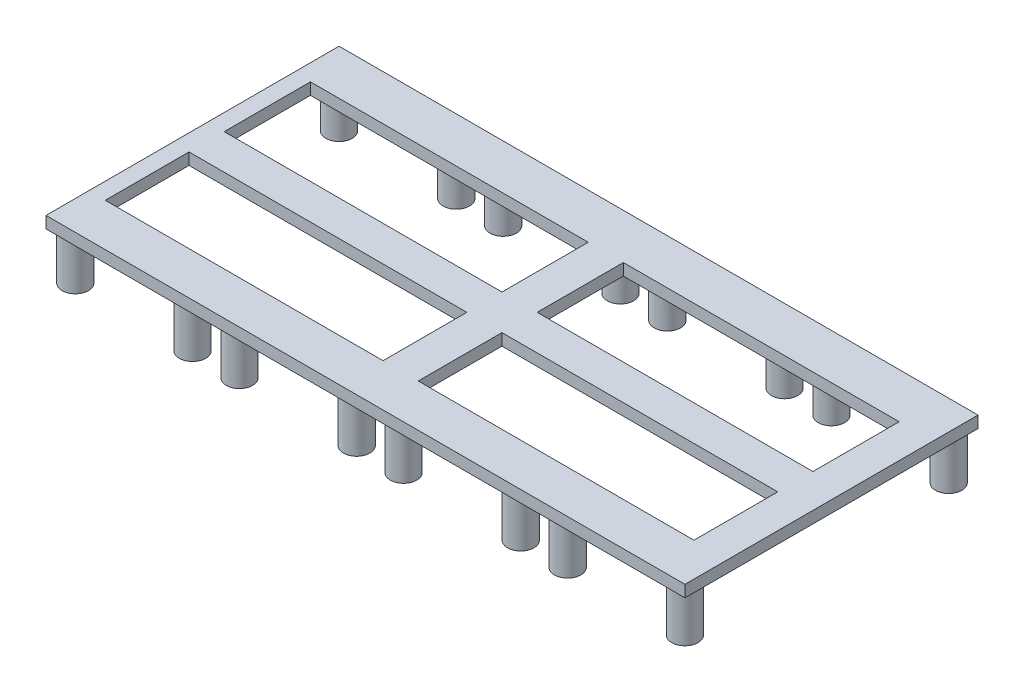
from build123d import *

# Parameters (mm, degrees)
SKETCH_1_W          = 25
SKETCH_1_H          = 50
SKETCH_1_R          = 2.25
SKETCH_1_W_2        = 20
SKETCH_1_H_2        = 45
EXTRUDE_1_DEPTH     = 2
EXTRUDE_2_DEPTH     = 8
SKETCH_4_W          = 28
SKETCH_4_H          = 50
EXTRUDE_3_DEPTH     = 2
EXTRUDE_4_DEPTH     = 8
SKETCH_6_W          = 28
SKETCH_6_H          = 50
EXTRUDE_5_DEPTH     = 2
EXTRUDE_6_DEPTH     = 8
SKETCH_8_W          = 28
SKETCH_8_H          = 50
EXTRUDE_7_DEPTH     = 2
EXTRUDE_8_DEPTH     = 8
SKETCH_10_W         = 47.04690413
SKETCH_10_H         = 14.711544942
SKETCH_10_W_2       = 47.389144047
SKETCH_10_H_2       = 14.288455058
CUT_EXTRUDE_1_DEPTH = 2


with BuildPart() as part:
    # 草图1 → 凸台-拉伸1 (new body)
    # profile 1 of 38: a face of its own
    with BuildSketch(Plane(origin=(0, 0, 0), x_dir=(1, 0, 0), z_dir=(0, 1, 0))):
        with Locations((-2.413747545, 14.420748303)):
            Rectangle(SKETCH_1_W, SKETCH_1_H)
        with Locations((-12.413747545, -8.079251697)):
            Circle(SKETCH_1_R, mode=Mode.SUBTRACT)
        with Locations((-12.413747545, 36.920748303)):
            Circle(SKETCH_1_R, mode=Mode.SUBTRACT)
        with Locations((7.586252455, 36.920748303)):
            Circle(SKETCH_1_R, mode=Mode.SUBTRACT)
        with Locations((7.586252455, -8.079251697)):
            Circle(SKETCH_1_R, mode=Mode.SUBTRACT)
        with Locations((-2.413747545, 14.420748303)):
            Rectangle(SKETCH_1_W_2, SKETCH_1_H_2, mode=Mode.SUBTRACT)
    # profile 2 of 38: a face of its own
    with BuildSketch(Plane(origin=(0, 0, 0), x_dir=(1, 0, 0), z_dir=(0, 1, 0))):
        with Locations((-2.413747545, 14.420748303)):
            Rectangle(SKETCH_1_W_2, SKETCH_1_H_2)
    # profile 3 of 38: a face of its own
    with BuildSketch(Plane(origin=(0, 0, 0), x_dir=(1, 0, 0), z_dir=(0, 1, 0))):
        with Locations((-12.413747545, 36.920748303)):
            Circle(SKETCH_1_R)
    # profile 4 of 38: a face of its own
    with BuildSketch(Plane(origin=(0, 0, 0), x_dir=(1, 0, 0), z_dir=(0, 1, 0))):
        with Locations((7.586252455, 36.920748303)):
            Circle(SKETCH_1_R)
    # profile 5 of 38: a face of its own
    with BuildSketch(Plane(origin=(0, 0, 0), x_dir=(1, 0, 0), z_dir=(0, 1, 0))):
        with Locations((7.586252455, -8.079251697)):
            Circle(SKETCH_1_R)
    # profile 6 of 38: a face of its own
    with BuildSketch(Plane(origin=(0, 0, 0), x_dir=(1, 0, 0), z_dir=(0, 1, 0))):
        with Locations((-12.413747545, -8.079251697)):
            Circle(SKETCH_1_R)
    # profile 7 of 38: a face of its own
    with BuildSketch(Plane(origin=(0, 0, 0), x_dir=(1, 0, 0), z_dir=(0, 1, 0))):
        with BuildLine():
            ThreePointArc((9.836252455, 36.920748303), (7.586252455, 39.170748303), (5.336252455, 36.920748303))
            Line((5.336252455, 36.920748303), (6.086252455, 36.920748303))
            ThreePointArc((6.086252455, 36.920748303), (7.586252455, 38.420748303), (9.086252455, 36.920748303))
            ThreePointArc((9.086252455, 36.920748303), (8.646912627, 35.860088131), (7.586252455, 35.420748303))
            Line((7.586252455, 35.420748303), (7.586252455, 34.670748303))
            ThreePointArc((7.586252455, 34.670748303), (9.177242713, 35.329758045), (9.836252455, 36.920748303))
        make_face()
    # profile 8 of 38: a face of its own
    with BuildSketch(Plane(origin=(0, 0, 0), x_dir=(1, 0, 0), z_dir=(0, 1, 0))):
        with BuildLine():
            Line((6.086252455, 36.920748303), (5.336252455, 36.920748303))
            ThreePointArc((5.336252455, 36.920748303), (5.995262198, 35.329758045), (7.586252455, 34.670748303))
            Line((7.586252455, 34.670748303), (7.586252455, 35.420748303))
            ThreePointArc((7.586252455, 35.420748303), (6.525592284, 35.860088131), (6.086252455, 36.920748303))
        make_face()
    # profile 9 of 38: a face of its own
    with BuildSketch(Plane(origin=(0, 0, 0), x_dir=(1, 0, 0), z_dir=(0, 1, 0))):
        with BuildLine():
            ThreePointArc((9.086252455, 36.920748303), (7.586252455, 38.420748303), (6.086252455, 36.920748303))
            Line((6.086252455, 36.920748303), (7.586252455, 36.920748303))
            Line((7.586252455, 36.920748303), (7.586252455, 35.420748303))
            ThreePointArc((7.586252455, 35.420748303), (8.646912627, 35.860088131), (9.086252455, 36.920748303))
        make_face()
    # profile 10 of 38: a face of its own
    with BuildSketch(Plane(origin=(0, 0, 0), x_dir=(1, 0, 0), z_dir=(0, 1, 0))):
        with BuildLine():
            Line((7.586252455, 36.920748303), (6.086252455, 36.920748303))
            ThreePointArc((6.086252455, 36.920748303), (6.525592284, 35.860088131), (7.586252455, 35.420748303))
            Line((7.586252455, 35.420748303), (7.586252455, 36.920748303))
        make_face()
    # profile 11 of 38: a face of its own
    with BuildSketch(Plane(origin=(0, 0, 0), x_dir=(1, 0, 0), z_dir=(0, 1, 0))):
        with BuildLine():
            ThreePointArc((9.086252455, 36.920748303), (7.586252455, 38.420748303), (6.086252455, 36.920748303))
            Line((6.086252455, 36.920748303), (7.586252455, 36.920748303))
            Line((7.586252455, 36.920748303), (7.586252455, 35.420748303))
            ThreePointArc((7.586252455, 35.420748303), (8.646912627, 35.860088131), (9.086252455, 36.920748303))
        make_face()
    # profile 12 of 38: a face of its own
    with BuildSketch(Plane(origin=(0, 0, 0), x_dir=(1, 0, 0), z_dir=(0, 1, 0))):
        with BuildLine():
            Line((7.586252455, 36.920748303), (6.086252455, 36.920748303))
            ThreePointArc((6.086252455, 36.920748303), (6.525592284, 35.860088131), (7.586252455, 35.420748303))
            Line((7.586252455, 35.420748303), (7.586252455, 36.920748303))
        make_face()
    # profile 13 of 38: a face of its own
    with BuildSketch(Plane(origin=(0, 0, 0), x_dir=(1, 0, 0), z_dir=(0, 1, 0))):
        with BuildLine():
            ThreePointArc((9.836252455, 36.920748303), (7.586252455, 39.170748303), (5.336252455, 36.920748303))
            Line((5.336252455, 36.920748303), (6.086252455, 36.920748303))
            ThreePointArc((6.086252455, 36.920748303), (7.586252455, 38.420748303), (9.086252455, 36.920748303))
            ThreePointArc((9.086252455, 36.920748303), (8.646912627, 35.860088131), (7.586252455, 35.420748303))
            Line((7.586252455, 35.420748303), (7.586252455, 34.670748303))
            ThreePointArc((7.586252455, 34.670748303), (9.177242713, 35.329758045), (9.836252455, 36.920748303))
        make_face()
    # profile 14 of 38: a face of its own
    with BuildSketch(Plane(origin=(0, 0, 0), x_dir=(1, 0, 0), z_dir=(0, 1, 0))):
        with BuildLine():
            Line((6.086252455, 36.920748303), (5.336252455, 36.920748303))
            ThreePointArc((5.336252455, 36.920748303), (5.995262198, 35.329758045), (7.586252455, 34.670748303))
            Line((7.586252455, 34.670748303), (7.586252455, 35.420748303))
            ThreePointArc((7.586252455, 35.420748303), (6.525592284, 35.860088131), (6.086252455, 36.920748303))
        make_face()
    # profile 15 of 38: a face of its own
    with BuildSketch(Plane(origin=(0, 0, 0), x_dir=(1, 0, 0), z_dir=(0, 1, 0))):
        with BuildLine():
            ThreePointArc((-12.413747545, 35.420748303), (-13.474407716, 37.981408475), (-10.913747545, 36.920748303))
            Line((-10.913747545, 36.920748303), (-10.163747545, 36.920748303))
            ThreePointArc((-10.163747545, 36.920748303), (-14.004737802, 38.511738561), (-12.413747545, 34.670748303))
            Line((-12.413747545, 34.670748303), (-12.413747545, 35.420748303))
        make_face()
    # profile 16 of 38: a face of its own
    with BuildSketch(Plane(origin=(0, 0, 0), x_dir=(1, 0, 0), z_dir=(0, 1, 0))):
        with BuildLine():
            Line((-10.163747545, 36.920748303), (-10.913747545, 36.920748303))
            ThreePointArc((-10.913747545, 36.920748303), (-11.353087373, 35.860088131), (-12.413747545, 35.420748303))
            Line((-12.413747545, 35.420748303), (-12.413747545, 34.670748303))
            ThreePointArc((-12.413747545, 34.670748303), (-10.822757287, 35.329758045), (-10.163747545, 36.920748303))
        make_face()
    # profile 17 of 38: a face of its own
    with BuildSketch(Plane(origin=(0, 0, 0), x_dir=(1, 0, 0), z_dir=(0, 1, 0))):
        with BuildLine():
            Line((-12.413747545, 35.420748303), (-12.413747545, 36.920748303))
            Line((-12.413747545, 36.920748303), (-10.913747545, 36.920748303))
            ThreePointArc((-10.913747545, 36.920748303), (-13.474407716, 37.981408475), (-12.413747545, 35.420748303))
        make_face()
    # profile 18 of 38: a face of its own
    with BuildSketch(Plane(origin=(0, 0, 0), x_dir=(1, 0, 0), z_dir=(0, 1, 0))):
        with BuildLine():
            Line((-10.913747545, 36.920748303), (-12.413747545, 36.920748303))
            Line((-12.413747545, 36.920748303), (-12.413747545, 35.420748303))
            ThreePointArc((-12.413747545, 35.420748303), (-11.353087373, 35.860088131), (-10.913747545, 36.920748303))
        make_face()
    # profile 19 of 38: a face of its own
    with BuildSketch(Plane(origin=(0, 0, 0), x_dir=(1, 0, 0), z_dir=(0, 1, 0))):
        with BuildLine():
            Line((-12.413747545, 35.420748303), (-12.413747545, 36.920748303))
            Line((-12.413747545, 36.920748303), (-10.913747545, 36.920748303))
            ThreePointArc((-10.913747545, 36.920748303), (-13.474407716, 37.981408475), (-12.413747545, 35.420748303))
        make_face()
    # profile 20 of 38: a face of its own
    with BuildSketch(Plane(origin=(0, 0, 0), x_dir=(1, 0, 0), z_dir=(0, 1, 0))):
        with BuildLine():
            Line((-10.913747545, 36.920748303), (-12.413747545, 36.920748303))
            Line((-12.413747545, 36.920748303), (-12.413747545, 35.420748303))
            ThreePointArc((-12.413747545, 35.420748303), (-11.353087373, 35.860088131), (-10.913747545, 36.920748303))
        make_face()
    # profile 21 of 38: a face of its own
    with BuildSketch(Plane(origin=(0, 0, 0), x_dir=(1, 0, 0), z_dir=(0, 1, 0))):
        with BuildLine():
            ThreePointArc((-12.413747545, 35.420748303), (-13.474407716, 37.981408475), (-10.913747545, 36.920748303))
            Line((-10.913747545, 36.920748303), (-10.163747545, 36.920748303))
            ThreePointArc((-10.163747545, 36.920748303), (-14.004737802, 38.511738561), (-12.413747545, 34.670748303))
            Line((-12.413747545, 34.670748303), (-12.413747545, 35.420748303))
        make_face()
    # profile 22 of 38: a face of its own
    with BuildSketch(Plane(origin=(0, 0, 0), x_dir=(1, 0, 0), z_dir=(0, 1, 0))):
        with BuildLine():
            Line((-10.163747545, 36.920748303), (-10.913747545, 36.920748303))
            ThreePointArc((-10.913747545, 36.920748303), (-11.353087373, 35.860088131), (-12.413747545, 35.420748303))
            Line((-12.413747545, 35.420748303), (-12.413747545, 34.670748303))
            ThreePointArc((-12.413747545, 34.670748303), (-10.822757287, 35.329758045), (-10.163747545, 36.920748303))
        make_face()
    # profile 23 of 38: a face of its own
    with BuildSketch(Plane(origin=(0, 0, 0), x_dir=(1, 0, 0), z_dir=(0, 1, 0))):
        with BuildLine():
            ThreePointArc((9.836252455, -8.079251697), (9.177242713, -6.488261439), (7.586252455, -5.829251697))
            Line((7.586252455, -5.829251697), (7.586252455, -6.579251697))
            ThreePointArc((7.586252455, -6.579251697), (8.646912627, -7.018591525), (9.086252455, -8.079251697))
            ThreePointArc((9.086252455, -8.079251697), (7.586252455, -9.579251697), (6.086252455, -8.079251697))
            Line((6.086252455, -8.079251697), (5.336252455, -8.079251697))
            ThreePointArc((5.336252455, -8.079251697), (7.586252455, -10.329251697), (9.836252455, -8.079251697))
        make_face()
    # profile 24 of 38: a face of its own
    with BuildSketch(Plane(origin=(0, 0, 0), x_dir=(1, 0, 0), z_dir=(0, 1, 0))):
        with BuildLine():
            Line((7.586252455, -6.579251697), (7.586252455, -5.829251697))
            ThreePointArc((7.586252455, -5.829251697), (5.995262198, -6.488261439), (5.336252455, -8.079251697))
            Line((5.336252455, -8.079251697), (6.086252455, -8.079251697))
            ThreePointArc((6.086252455, -8.079251697), (6.525592284, -7.018591525), (7.586252455, -6.579251697))
        make_face()
    # profile 25 of 38: a face of its own
    with BuildSketch(Plane(origin=(0, 0, 0), x_dir=(1, 0, 0), z_dir=(0, 1, 0))):
        with BuildLine():
            ThreePointArc((9.086252455, -8.079251697), (8.646912627, -7.018591525), (7.586252455, -6.579251697))
            Line((7.586252455, -6.579251697), (7.586252455, -8.079251697))
            Line((7.586252455, -8.079251697), (6.086252455, -8.079251697))
            ThreePointArc((6.086252455, -8.079251697), (7.586252455, -9.579251697), (9.086252455, -8.079251697))
        make_face()
    # profile 26 of 38: a face of its own
    with BuildSketch(Plane(origin=(0, 0, 0), x_dir=(1, 0, 0), z_dir=(0, 1, 0))):
        with BuildLine():
            Line((7.586252455, -8.079251697), (7.586252455, -6.579251697))
            ThreePointArc((7.586252455, -6.579251697), (6.525592284, -7.018591525), (6.086252455, -8.079251697))
            Line((6.086252455, -8.079251697), (7.586252455, -8.079251697))
        make_face()
    # profile 27 of 38: a face of its own
    with BuildSketch(Plane(origin=(0, 0, 0), x_dir=(1, 0, 0), z_dir=(0, 1, 0))):
        with BuildLine():
            ThreePointArc((9.836252455, -8.079251697), (9.177242713, -6.488261439), (7.586252455, -5.829251697))
            Line((7.586252455, -5.829251697), (7.586252455, -6.579251697))
            ThreePointArc((7.586252455, -6.579251697), (8.646912627, -7.018591525), (9.086252455, -8.079251697))
            ThreePointArc((9.086252455, -8.079251697), (7.586252455, -9.579251697), (6.086252455, -8.079251697))
            Line((6.086252455, -8.079251697), (5.336252455, -8.079251697))
            ThreePointArc((5.336252455, -8.079251697), (7.586252455, -10.329251697), (9.836252455, -8.079251697))
        make_face()
    # profile 28 of 38: a face of its own
    with BuildSketch(Plane(origin=(0, 0, 0), x_dir=(1, 0, 0), z_dir=(0, 1, 0))):
        with BuildLine():
            Line((7.586252455, -6.579251697), (7.586252455, -5.829251697))
            ThreePointArc((7.586252455, -5.829251697), (5.995262198, -6.488261439), (5.336252455, -8.079251697))
            Line((5.336252455, -8.079251697), (6.086252455, -8.079251697))
            ThreePointArc((6.086252455, -8.079251697), (6.525592284, -7.018591525), (7.586252455, -6.579251697))
        make_face()
    # profile 29 of 38: a face of its own
    with BuildSketch(Plane(origin=(0, 0, 0), x_dir=(1, 0, 0), z_dir=(0, 1, 0))):
        with BuildLine():
            ThreePointArc((9.086252455, -8.079251697), (8.646912627, -7.018591525), (7.586252455, -6.579251697))
            Line((7.586252455, -6.579251697), (7.586252455, -8.079251697))
            Line((7.586252455, -8.079251697), (6.086252455, -8.079251697))
            ThreePointArc((6.086252455, -8.079251697), (7.586252455, -9.579251697), (9.086252455, -8.079251697))
        make_face()
    # profile 30 of 38: a face of its own
    with BuildSketch(Plane(origin=(0, 0, 0), x_dir=(1, 0, 0), z_dir=(0, 1, 0))):
        with BuildLine():
            Line((7.586252455, -8.079251697), (7.586252455, -6.579251697))
            ThreePointArc((7.586252455, -6.579251697), (6.525592284, -7.018591525), (6.086252455, -8.079251697))
            Line((6.086252455, -8.079251697), (7.586252455, -8.079251697))
        make_face()
    # profile 31 of 38: a face of its own
    with BuildSketch(Plane(origin=(0, 0, 0), x_dir=(1, 0, 0), z_dir=(0, 1, 0))):
        with BuildLine():
            ThreePointArc((-10.913747545, -8.079251697), (-11.353087373, -7.018591525), (-12.413747545, -6.579251697))
            Line((-12.413747545, -6.579251697), (-12.413747545, -8.079251697))
            Line((-12.413747545, -8.079251697), (-10.913747545, -8.079251697))
        make_face()
    # profile 32 of 38: a face of its own
    with BuildSketch(Plane(origin=(0, 0, 0), x_dir=(1, 0, 0), z_dir=(0, 1, 0))):
        with BuildLine():
            Line((-12.413747545, -8.079251697), (-12.413747545, -6.579251697))
            ThreePointArc((-12.413747545, -6.579251697), (-13.474407716, -9.139911869), (-10.913747545, -8.079251697))
            Line((-10.913747545, -8.079251697), (-12.413747545, -8.079251697))
        make_face()
    # profile 33 of 38: a face of its own
    with BuildSketch(Plane(origin=(0, 0, 0), x_dir=(1, 0, 0), z_dir=(0, 1, 0))):
        with BuildLine():
            ThreePointArc((-10.163747545, -8.079251697), (-10.822757287, -6.488261439), (-12.413747545, -5.829251697))
            Line((-12.413747545, -5.829251697), (-12.413747545, -6.579251697))
            ThreePointArc((-12.413747545, -6.579251697), (-11.353087373, -7.018591525), (-10.913747545, -8.079251697))
            Line((-10.913747545, -8.079251697), (-10.163747545, -8.079251697))
        make_face()
    # profile 34 of 38: a face of its own
    with BuildSketch(Plane(origin=(0, 0, 0), x_dir=(1, 0, 0), z_dir=(0, 1, 0))):
        with BuildLine():
            Line((-12.413747545, -6.579251697), (-12.413747545, -5.829251697))
            ThreePointArc((-12.413747545, -5.829251697), (-14.004737802, -9.670241955), (-10.163747545, -8.079251697))
            Line((-10.163747545, -8.079251697), (-10.913747545, -8.079251697))
            ThreePointArc((-10.913747545, -8.079251697), (-13.474407716, -9.139911869), (-12.413747545, -6.579251697))
        make_face()
    # profile 35 of 38: a face of its own
    with BuildSketch(Plane(origin=(0, 0, 0), x_dir=(1, 0, 0), z_dir=(0, 1, 0))):
        with BuildLine():
            ThreePointArc((-10.913747545, -8.079251697), (-11.353087373, -7.018591525), (-12.413747545, -6.579251697))
            Line((-12.413747545, -6.579251697), (-12.413747545, -8.079251697))
            Line((-12.413747545, -8.079251697), (-10.913747545, -8.079251697))
        make_face()
    # profile 36 of 38: a face of its own
    with BuildSketch(Plane(origin=(0, 0, 0), x_dir=(1, 0, 0), z_dir=(0, 1, 0))):
        with BuildLine():
            Line((-12.413747545, -8.079251697), (-12.413747545, -6.579251697))
            ThreePointArc((-12.413747545, -6.579251697), (-13.474407716, -9.139911869), (-10.913747545, -8.079251697))
            Line((-10.913747545, -8.079251697), (-12.413747545, -8.079251697))
        make_face()
    # profile 37 of 38: a face of its own
    with BuildSketch(Plane(origin=(0, 0, 0), x_dir=(1, 0, 0), z_dir=(0, 1, 0))):
        with BuildLine():
            ThreePointArc((-10.163747545, -8.079251697), (-10.822757287, -6.488261439), (-12.413747545, -5.829251697))
            Line((-12.413747545, -5.829251697), (-12.413747545, -6.579251697))
            ThreePointArc((-12.413747545, -6.579251697), (-11.353087373, -7.018591525), (-10.913747545, -8.079251697))
            Line((-10.913747545, -8.079251697), (-10.163747545, -8.079251697))
        make_face()
    # profile 38 of 38: a face of its own
    with BuildSketch(Plane(origin=(0, 0, 0), x_dir=(1, 0, 0), z_dir=(0, 1, 0))):
        with BuildLine():
            Line((-12.413747545, -6.579251697), (-12.413747545, -5.829251697))
            ThreePointArc((-12.413747545, -5.829251697), (-14.004737802, -9.670241955), (-10.163747545, -8.079251697))
            Line((-10.163747545, -8.079251697), (-10.913747545, -8.079251697))
            ThreePointArc((-10.913747545, -8.079251697), (-13.474407716, -9.139911869), (-12.413747545, -6.579251697))
        make_face()
    extrude(amount=EXTRUDE_1_DEPTH)

    # 草图2 → 凸台-拉伸2 (add)
    with BuildSketch(Plane.XZ):
        with BuildLine():
            ThreePointArc((-12.413747545, 6.579251697), (-13.474407716, 9.139911869), (-10.913747545, 8.079251697))
            Line((-10.913747545, 8.079251697), (-10.163747545, 8.079251697))
            ThreePointArc((-10.163747545, 8.079251697), (-14.004737802, 9.670241955), (-12.413747545, 5.829251697))
            Line((-12.413747545, 5.829251697), (-12.413747545, 6.579251697))
        make_face()
        with BuildLine():
            Line((-10.163747545, 8.079251697), (-10.913747545, 8.079251697))
            ThreePointArc((-10.913747545, 8.079251697), (-11.353087373, 7.018591525), (-12.413747545, 6.579251697))
            Line((-12.413747545, 6.579251697), (-12.413747545, 5.829251697))
            ThreePointArc((-12.413747545, 5.829251697), (-10.822757287, 6.488261439), (-10.163747545, 8.079251697))
        make_face()
        with BuildLine():
            ThreePointArc((9.836252455, 8.079251697), (7.586252455, 10.329251697), (5.336252455, 8.079251697))
            Line((5.336252455, 8.079251697), (6.086252455, 8.079251697))
            ThreePointArc((6.086252455, 8.079251697), (7.586252455, 9.579251697), (9.086252455, 8.079251697))
            ThreePointArc((9.086252455, 8.079251697), (8.646912627, 7.018591525), (7.586252455, 6.579251697))
            Line((7.586252455, 6.579251697), (7.586252455, 5.829251697))
            ThreePointArc((7.586252455, 5.829251697), (9.177242713, 6.488261439), (9.836252455, 8.079251697))
        make_face()
        with BuildLine():
            Line((6.086252455, 8.079251697), (5.336252455, 8.079251697))
            ThreePointArc((5.336252455, 8.079251697), (5.995262198, 6.488261439), (7.586252455, 5.829251697))
            Line((7.586252455, 5.829251697), (7.586252455, 6.579251697))
            ThreePointArc((7.586252455, 6.579251697), (6.525592284, 7.018591525), (6.086252455, 8.079251697))
        make_face()
        with BuildLine():
            ThreePointArc((-10.163747545, -36.920748303), (-10.822757287, -35.329758045), (-12.413747545, -34.670748303))
            Line((-12.413747545, -34.670748303), (-12.413747545, -35.420748303))
            ThreePointArc((-12.413747545, -35.420748303), (-11.353087373, -35.860088131), (-10.913747545, -36.920748303))
            Line((-10.913747545, -36.920748303), (-10.163747545, -36.920748303))
        make_face()
        with BuildLine():
            Line((-12.413747545, -35.420748303), (-12.413747545, -34.670748303))
            ThreePointArc((-12.413747545, -34.670748303), (-14.004737802, -38.511738561), (-10.163747545, -36.920748303))
            Line((-10.163747545, -36.920748303), (-10.913747545, -36.920748303))
            ThreePointArc((-10.913747545, -36.920748303), (-13.474407716, -37.981408475), (-12.413747545, -35.420748303))
        make_face()
        with BuildLine():
            ThreePointArc((9.836252455, -36.920748303), (9.177242713, -35.329758045), (7.586252455, -34.670748303))
            Line((7.586252455, -34.670748303), (7.586252455, -35.420748303))
            ThreePointArc((7.586252455, -35.420748303), (8.646912627, -35.860088131), (9.086252455, -36.920748303))
            ThreePointArc((9.086252455, -36.920748303), (7.586252455, -38.420748303), (6.086252455, -36.920748303))
            Line((6.086252455, -36.920748303), (5.336252455, -36.920748303))
            ThreePointArc((5.336252455, -36.920748303), (7.586252455, -39.170748303), (9.836252455, -36.920748303))
        make_face()
        with BuildLine():
            Line((7.586252455, -35.420748303), (7.586252455, -34.670748303))
            ThreePointArc((7.586252455, -34.670748303), (5.995262198, -35.329758045), (5.336252455, -36.920748303))
            Line((5.336252455, -36.920748303), (6.086252455, -36.920748303))
            ThreePointArc((6.086252455, -36.920748303), (6.525592284, -35.860088131), (7.586252455, -35.420748303))
        make_face()
    extrude(amount=EXTRUDE_2_DEPTH)

    # 草图4 → 凸台-拉伸3 (add)
    with BuildSketch(Plane.XZ):
        with Locations((24.086252455, -14.420748303)):
            Rectangle(SKETCH_4_W, SKETCH_4_H)
    extrude(amount=-EXTRUDE_3_DEPTH)

    # 草图5 → 凸台-拉伸4 (add)
    with BuildSketch(Plane.XZ):
        with BuildLine():
            ThreePointArc((15.586252455, 6.579251697), (14.525592284, 9.139911869), (17.086252455, 8.079251697))
            Line((17.086252455, 8.079251697), (17.836252455, 8.079251697))
            ThreePointArc((17.836252455, 8.079251697), (13.995262198, 9.670241955), (15.586252455, 5.829251697))
            Line((15.586252455, 5.829251697), (15.586252455, 6.579251697))
        make_face()
        with BuildLine():
            Line((17.836252455, 8.079251697), (17.086252455, 8.079251697))
            ThreePointArc((17.086252455, 8.079251697), (16.646912627, 7.018591525), (15.586252455, 6.579251697))
            Line((15.586252455, 6.579251697), (15.586252455, 5.829251697))
            ThreePointArc((15.586252455, 5.829251697), (17.177242713, 6.488261439), (17.836252455, 8.079251697))
        make_face()
        with BuildLine():
            ThreePointArc((37.836252455, 8.079251697), (35.586252455, 10.329251697), (33.336252455, 8.079251697))
            Line((33.336252455, 8.079251697), (34.286252455, 8.079251697))
            ThreePointArc((34.286252455, 8.079251697), (35.586252455, 9.379251697), (36.886252455, 8.079251697))
            ThreePointArc((36.886252455, 8.079251697), (36.505491271, 7.160012881), (35.586252455, 6.779251697))
            Line((35.586252455, 6.779251697), (35.586252455, 5.829251697))
            ThreePointArc((35.586252455, 5.829251697), (37.177242713, 6.488261439), (37.836252455, 8.079251697))
        make_face()
        with BuildLine():
            Line((34.286252455, 8.079251697), (33.336252455, 8.079251697))
            ThreePointArc((33.336252455, 8.079251697), (33.995262198, 6.488261439), (35.586252455, 5.829251697))
            Line((35.586252455, 5.829251697), (35.586252455, 6.779251697))
            ThreePointArc((35.586252455, 6.779251697), (34.66701364, 7.160012881), (34.286252455, 8.079251697))
        make_face()
        with BuildLine():
            ThreePointArc((17.836252455, -36.920748303), (17.177242713, -35.329758045), (15.586252455, -34.670748303))
            Line((15.586252455, -34.670748303), (15.586252455, -35.420748303))
            ThreePointArc((15.586252455, -35.420748303), (16.646912627, -35.860088131), (17.086252455, -36.920748303))
            Line((17.086252455, -36.920748303), (17.836252455, -36.920748303))
        make_face()
        with BuildLine():
            Line((15.586252455, -35.420748303), (15.586252455, -34.670748303))
            ThreePointArc((15.586252455, -34.670748303), (13.995262198, -38.511738561), (17.836252455, -36.920748303))
            Line((17.836252455, -36.920748303), (17.086252455, -36.920748303))
            ThreePointArc((17.086252455, -36.920748303), (14.525592284, -37.981408475), (15.586252455, -35.420748303))
        make_face()
        with BuildLine():
            ThreePointArc((37.836252455, -36.920748303), (37.177242713, -35.329758045), (35.586252455, -34.670748303))
            Line((35.586252455, -34.670748303), (35.586252455, -35.420748303))
            ThreePointArc((35.586252455, -35.420748303), (36.646912627, -35.860088131), (37.086252455, -36.920748303))
            ThreePointArc((37.086252455, -36.920748303), (35.586252455, -38.420748303), (34.086252455, -36.920748303))
            Line((34.086252455, -36.920748303), (33.336252455, -36.920748303))
            ThreePointArc((33.336252455, -36.920748303), (35.586252455, -39.170748303), (37.836252455, -36.920748303))
        make_face()
        with BuildLine():
            Line((35.586252455, -35.420748303), (35.586252455, -34.670748303))
            ThreePointArc((35.586252455, -34.670748303), (33.995262198, -35.329758045), (33.336252455, -36.920748303))
            Line((33.336252455, -36.920748303), (34.086252455, -36.920748303))
            ThreePointArc((34.086252455, -36.920748303), (34.525592284, -35.860088131), (35.586252455, -35.420748303))
        make_face()
    extrude(amount=EXTRUDE_4_DEPTH)

    # 草图6 → 凸台-拉伸5 (add)
    with BuildSketch(Plane.XZ):
        with Locations((52.086252455, -14.420748303)):
            Rectangle(SKETCH_6_W, SKETCH_6_H)
    extrude(amount=-EXTRUDE_5_DEPTH)

    # 草图7 → 凸台-拉伸6 (add)
    with BuildSketch(Plane.XZ):
        with BuildLine():
            ThreePointArc((43.586252455, 6.579251697), (42.525592284, 9.139911869), (45.086252455, 8.079251697))
            Line((45.086252455, 8.079251697), (45.836252455, 8.079251697))
            ThreePointArc((45.836252455, 8.079251697), (41.995262198, 9.670241955), (43.586252455, 5.829251697))
            Line((43.586252455, 5.829251697), (43.586252455, 6.579251697))
        make_face()
        with BuildLine():
            Line((45.836252455, 8.079251697), (45.086252455, 8.079251697))
            ThreePointArc((45.086252455, 8.079251697), (44.646912627, 7.018591525), (43.586252455, 6.579251697))
            Line((43.586252455, 6.579251697), (43.586252455, 5.829251697))
            ThreePointArc((43.586252455, 5.829251697), (45.177242713, 6.488261439), (45.836252455, 8.079251697))
        make_face()
        with BuildLine():
            ThreePointArc((65.836252455, 8.079251697), (63.586252455, 10.329251697), (61.336252455, 8.079251697))
            Line((61.336252455, 8.079251697), (62.086252455, 8.079251697))
            ThreePointArc((62.086252455, 8.079251697), (63.586252455, 9.579251697), (65.086252455, 8.079251697))
            ThreePointArc((65.086252455, 8.079251697), (64.646912627, 7.018591525), (63.586252455, 6.579251697))
            Line((63.586252455, 6.579251697), (63.586252455, 5.829251697))
            ThreePointArc((63.586252455, 5.829251697), (65.177242713, 6.488261439), (65.836252455, 8.079251697))
        make_face()
        with BuildLine():
            Line((62.086252455, 8.079251697), (61.336252455, 8.079251697))
            ThreePointArc((61.336252455, 8.079251697), (61.995262198, 6.488261439), (63.586252455, 5.829251697))
            Line((63.586252455, 5.829251697), (63.586252455, 6.579251697))
            ThreePointArc((63.586252455, 6.579251697), (62.525592284, 7.018591525), (62.086252455, 8.079251697))
        make_face()
        with BuildLine():
            ThreePointArc((45.836252455, -36.920748303), (45.177242713, -35.329758045), (43.586252455, -34.670748303))
            Line((43.586252455, -34.670748303), (43.586252455, -35.420748303))
            ThreePointArc((43.586252455, -35.420748303), (44.646912627, -35.860088131), (45.086252455, -36.920748303))
            Line((45.086252455, -36.920748303), (45.836252455, -36.920748303))
        make_face()
        with BuildLine():
            Line((43.586252455, -35.420748303), (43.586252455, -34.670748303))
            ThreePointArc((43.586252455, -34.670748303), (41.995262198, -38.511738561), (45.836252455, -36.920748303))
            Line((45.836252455, -36.920748303), (45.086252455, -36.920748303))
            ThreePointArc((45.086252455, -36.920748303), (42.525592284, -37.981408475), (43.586252455, -35.420748303))
        make_face()
        with BuildLine():
            ThreePointArc((65.836252455, -36.920748303), (65.177242713, -35.329758045), (63.586252455, -34.670748303))
            Line((63.586252455, -34.670748303), (63.586252455, -35.420748303))
            ThreePointArc((63.586252455, -35.420748303), (64.646912627, -35.860088131), (65.086252455, -36.920748303))
            ThreePointArc((65.086252455, -36.920748303), (63.586252455, -38.420748303), (62.086252455, -36.920748303))
            Line((62.086252455, -36.920748303), (61.336252455, -36.920748303))
            ThreePointArc((61.336252455, -36.920748303), (63.586252455, -39.170748303), (65.836252455, -36.920748303))
        make_face()
        with BuildLine():
            Line((63.586252455, -35.420748303), (63.586252455, -34.670748303))
            ThreePointArc((63.586252455, -34.670748303), (61.995262198, -35.329758045), (61.336252455, -36.920748303))
            Line((61.336252455, -36.920748303), (62.086252455, -36.920748303))
            ThreePointArc((62.086252455, -36.920748303), (62.525592284, -35.860088131), (63.586252455, -35.420748303))
        make_face()
    extrude(amount=EXTRUDE_6_DEPTH)

    # 草图8 → 凸台-拉伸7 (add)
    with BuildSketch(Plane.XZ):
        with Locations((80.086252455, -14.420748303)):
            Rectangle(SKETCH_8_W, SKETCH_8_H)
    extrude(amount=-EXTRUDE_7_DEPTH)

    # 草图9 → 凸台-拉伸8 (add)
    with BuildSketch(Plane.XZ):
        with BuildLine():
            ThreePointArc((71.586252455, 6.579251697), (70.525592284, 9.139911869), (73.086252455, 8.079251697))
            Line((73.086252455, 8.079251697), (73.836252455, 8.079251697))
            ThreePointArc((73.836252455, 8.079251697), (69.995262198, 9.670241955), (71.586252455, 5.829251697))
            Line((71.586252455, 5.829251697), (71.586252455, 6.579251697))
        make_face()
        with BuildLine():
            Line((73.836252455, 8.079251697), (73.086252455, 8.079251697))
            ThreePointArc((73.086252455, 8.079251697), (72.646912627, 7.018591525), (71.586252455, 6.579251697))
            Line((71.586252455, 6.579251697), (71.586252455, 5.829251697))
            ThreePointArc((71.586252455, 5.829251697), (73.177242713, 6.488261439), (73.836252455, 8.079251697))
        make_face()
        with BuildLine():
            ThreePointArc((93.836252455, 8.079251697), (91.586252455, 10.329251697), (89.336252455, 8.079251697))
            Line((89.336252455, 8.079251697), (90.086252455, 8.079251697))
            ThreePointArc((90.086252455, 8.079251697), (91.586252455, 9.579251697), (93.086252455, 8.079251697))
            ThreePointArc((93.086252455, 8.079251697), (92.646912627, 7.018591525), (91.586252455, 6.579251697))
            Line((91.586252455, 6.579251697), (91.586252455, 5.829251697))
            ThreePointArc((91.586252455, 5.829251697), (93.177242713, 6.488261439), (93.836252455, 8.079251697))
        make_face()
        with BuildLine():
            Line((90.086252455, 8.079251697), (89.336252455, 8.079251697))
            ThreePointArc((89.336252455, 8.079251697), (89.995262198, 6.488261439), (91.586252455, 5.829251697))
            Line((91.586252455, 5.829251697), (91.586252455, 6.579251697))
            ThreePointArc((91.586252455, 6.579251697), (90.525592284, 7.018591525), (90.086252455, 8.079251697))
        make_face()
        with BuildLine():
            ThreePointArc((73.836252455, -36.920748303), (73.177242713, -35.329758045), (71.586252455, -34.670748303))
            Line((71.586252455, -34.670748303), (71.586252455, -35.420748303))
            ThreePointArc((71.586252455, -35.420748303), (72.646912627, -35.860088131), (73.086252455, -36.920748303))
            Line((73.086252455, -36.920748303), (73.836252455, -36.920748303))
        make_face()
        with BuildLine():
            Line((71.586252455, -35.420748303), (71.586252455, -34.670748303))
            ThreePointArc((71.586252455, -34.670748303), (69.995262198, -38.511738561), (73.836252455, -36.920748303))
            Line((73.836252455, -36.920748303), (73.086252455, -36.920748303))
            ThreePointArc((73.086252455, -36.920748303), (70.525592284, -37.981408475), (71.586252455, -35.420748303))
        make_face()
        with BuildLine():
            ThreePointArc((93.836252455, -36.920748303), (93.177242713, -35.329758045), (91.586252455, -34.670748303))
            Line((91.586252455, -34.670748303), (91.586252455, -35.420748303))
            ThreePointArc((91.586252455, -35.420748303), (92.646912627, -35.860088131), (93.086252455, -36.920748303))
            ThreePointArc((93.086252455, -36.920748303), (91.586252455, -38.420748303), (90.086252455, -36.920748303))
            Line((90.086252455, -36.920748303), (89.336252455, -36.920748303))
            ThreePointArc((89.336252455, -36.920748303), (91.586252455, -39.170748303), (93.836252455, -36.920748303))
        make_face()
        with BuildLine():
            Line((91.586252455, -35.420748303), (91.586252455, -34.670748303))
            ThreePointArc((91.586252455, -34.670748303), (89.995262198, -35.329758045), (89.336252455, -36.920748303))
            Line((89.336252455, -36.920748303), (90.086252455, -36.920748303))
            ThreePointArc((90.086252455, -36.920748303), (90.525592284, -35.860088131), (91.586252455, -35.420748303))
        make_face()
    extrude(amount=EXTRUDE_8_DEPTH)

    # 草图10 → 切除-拉伸1 (cut)
    with BuildSketch(Plane.XZ):
        with Locations((64.82143243, -24.352768928)):
            Rectangle(SKETCH_10_W, SKETCH_10_H)
        with Locations((11.603408341, -24.352768928)):
            Rectangle(SKETCH_10_W_2, SKETCH_10_H)
        with Locations((64.82143243, -3.852768928)):
            Rectangle(SKETCH_10_W, SKETCH_10_H_2)
        with Locations((11.603408341, -3.852768928)):
            Rectangle(SKETCH_10_W_2, SKETCH_10_H_2)
    extrude(amount=-CUT_EXTRUDE_1_DEPTH, mode=Mode.SUBTRACT)


solid = part.part
